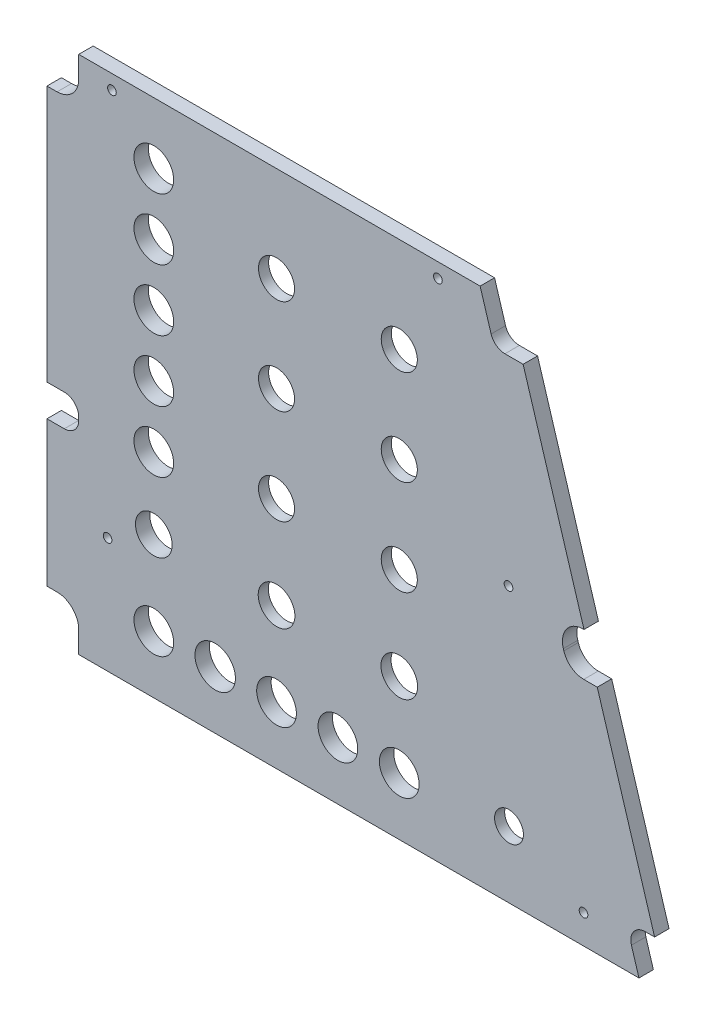
from build123d import *

# Parameters (mm, degrees)
SKETCH1_R           = 6.875
SKETCH1_R_2         = 6.25
SKETCH1_R_3         = 6.35
SKETCH1_R_4         = 7
SKETCH1_R_5         = 5
SKETCH1_R_6         = 1.5
BOSS_EXTRUDE1_DEPTH = 5
CUT_EXTRUDE1_START  = -5
SKETCH6_R           = 10
CUT_EXTRUDE1_DEPTH  = 1.5
CUT_EXTRUDE2_DEPTH  = 5


with BuildPart() as part:
    # Sketch1 → Boss-Extrude1 (new body)
    with BuildSketch(Plane.XY):
        Polygon((-74.139483312, 85.643418081), (85.860516688, 85.643418081), (140.860516688, -94.356581919), (-74.139483312, -94.356581919), align=None)
        with Locations((-37.139483312, 64.393418081)):
            Circle(SKETCH1_R, mode=Mode.SUBTRACT)
        with Locations((-37.139483312, 43.143418081)):
            Circle(SKETCH1_R, mode=Mode.SUBTRACT)
        with Locations((-37.139483312, 21.893418081)):
            Circle(SKETCH1_R, mode=Mode.SUBTRACT)
        with Locations((-37.139483312, 0.643418081)):
            Circle(SKETCH1_R, mode=Mode.SUBTRACT)
        with Locations((-37.139483312, -20.606581919)):
            Circle(SKETCH1_R, mode=Mode.SUBTRACT)
        with Locations((5.360516688, 52.643418081)):
            Circle(SKETCH1_R_2, mode=Mode.SUBTRACT)
        with Locations((5.360516688, 19.643418081)):
            Circle(SKETCH1_R_2, mode=Mode.SUBTRACT)
        with Locations((5.360516688, -13.356581919)):
            Circle(SKETCH1_R_2, mode=Mode.SUBTRACT)
        with Locations(Location((47.860516688, -13.356581919, 0), (0, 0, 180))):
            Circle(SKETCH1_R_2, mode=Mode.SUBTRACT)
        with Locations(Location((47.860516688, 19.643418081, 0), (0, 0, 180))):
            Circle(SKETCH1_R_2, mode=Mode.SUBTRACT)
        with Locations(Location((47.860516688, 52.643418081, 0), (0, 0, 180))):
            Circle(SKETCH1_R_2, mode=Mode.SUBTRACT)
        with Locations((-37.139483312, -45.356581919)):
            Circle(SKETCH1_R_3, mode=Mode.SUBTRACT)
        with Locations((5.360516688, -45.356581919)):
            Circle(SKETCH1_R_3, mode=Mode.SUBTRACT)
        with Locations((47.860516688, -45.356581919)):
            Circle(SKETCH1_R_3, mode=Mode.SUBTRACT)
        with Locations((-37.139483312, -74.356581919)):
            Circle(SKETCH1_R, mode=Mode.SUBTRACT)
        with Locations((-15.889483312, -74.356581919)):
            Circle(SKETCH1_R_4, mode=Mode.SUBTRACT)
        with Locations((5.360516688, -74.356581919)):
            Circle(SKETCH1_R, mode=Mode.SUBTRACT)
        with Locations((26.610516688, -74.356581919)):
            Circle(SKETCH1_R, mode=Mode.SUBTRACT)
        with Locations((47.860516688, -74.356581919)):
            Circle(SKETCH1_R, mode=Mode.SUBTRACT)
        with Locations((85.860516688, -71.356581919)):
            Circle(SKETCH1_R_5, mode=Mode.SUBTRACT)
        with Locations((-51.639483312, 80.643418081)):
            Circle(SKETCH1_R_6, mode=Mode.SUBTRACT)
        with Locations((61.247280265, 80.643418081)):
            Circle(SKETCH1_R_6, mode=Mode.SUBTRACT)
        with Locations((85.691724709, 0.643418081)):
            Circle(SKETCH1_R_6, mode=Mode.SUBTRACT)
        with Locations((111.663946931, -84.356581919)):
            Circle(SKETCH1_R_6, mode=Mode.SUBTRACT)
        with Locations((-53.139483312, -54.356581919)):
            Circle(SKETCH1_R_6, mode=Mode.SUBTRACT)
    extrude(amount=BOSS_EXTRUDE1_DEPTH)

    # Sketch6 → Cut-Extrude1 (cut)
    with BuildSketch(Plane.XY.offset(5).offset(CUT_EXTRUDE1_START)):
        with Locations((5.360516688, 52.643418081)):
            Circle(SKETCH6_R)
        with Locations((47.860516688, 52.643418081)):
            Circle(SKETCH6_R)
        with Locations((47.860516688, -45.356581919)):
            Circle(SKETCH6_R)
        with Locations((47.860516688, -13.356581919)):
            Circle(SKETCH6_R)
        with Locations((47.860516688, 19.643418081)):
            Circle(SKETCH6_R)
        with Locations((5.360516688, 19.643418081)):
            Circle(SKETCH6_R)
        with Locations((5.360516688, -13.356581919)):
            Circle(SKETCH6_R)
        with Locations((5.360516688, -45.356581919)):
            Circle(SKETCH6_R)
        with Locations((85.860516688, -71.356581919)):
            Circle(SKETCH6_R)
    extrude(amount=CUT_EXTRUDE1_DEPTH, mode=Mode.SUBTRACT)

    # Sketch3 → Cut-Extrude2 (cut)
    with BuildSketch(Plane.XY):
        with BuildLine():
            Line((-74.139483312, 70.643418081), (-70.639483312, 70.643418081))
            ThreePointArc((-70.639483312, 70.643418081), (-65.336182453, 72.840117222), (-63.139483312, 78.143418081))
            Line((-63.139483312, 78.143418081), (-63.139483312, 85.643418081))
            Line((-63.139483312, 85.643418081), (-74.139483312, 85.643418081))
            Line((-74.139483312, 85.643418081), (-74.139483312, 70.643418081))
        make_face()
        with BuildLine():
            Line((136.277183355, -79.356581919), (133.033163973, -79.356581919))
            ThreePointArc((133.033163973, -79.356581919), (129.014117855, -81.382146123), (128.251406117, -85.817674597))
            Line((128.251406117, -85.817674597), (130.860516688, -94.356581919))
            Line((130.860516688, -94.356581919), (140.860516688, -94.356581919))
            Line((140.860516688, -94.356581919), (136.277183355, -79.356581919))
        make_face()
        with BuildLine():
            Line((75.860516688, 85.643418081), (79.668072784, 73.182325403))
            ThreePointArc((79.668072784, 73.182325403), (81.475394843, 70.624371963), (84.449830639, 69.643418081))
            Line((84.449830639, 69.643418081), (90.749405577, 69.643418081))
            Line((90.749405577, 69.643418081), (85.860516688, 85.643418081))
            Line((85.860516688, 85.643418081), (75.860516688, 85.643418081))
        make_face()
        with BuildLine():
            Line((-74.139483312, -79.356581919), (-70.639483312, -79.356581919))
            ThreePointArc((-70.639483312, -79.356581919), (-65.336182453, -81.553281061), (-63.139483312, -86.856581919))
            Line((-63.139483312, -86.856581919), (-63.139483312, -94.356581919))
            Line((-63.139483312, -94.356581919), (-74.139483312, -94.356581919))
            Line((-74.139483312, -94.356581919), (-74.139483312, -79.356581919))
        make_face()
        with BuildLine():
            Line((-74.139483312, -18.146581919), (-68.139483312, -18.146581919))
            ThreePointArc((-68.139483312, -18.146581919), (-64.603949406, -19.611048014), (-63.139483312, -23.146581919))
            Line((-63.139483312, -23.146581919), (-63.139483312, -24.146581919))
            ThreePointArc((-63.139483312, -24.146581919), (-64.603949406, -27.682115825), (-68.139483312, -29.146581919))
            Line((-68.139483312, -29.146581919), (-74.139483312, -29.146581919))
            Line((-74.139483312, -29.146581919), (-74.139483312, -18.146581919))
        make_face()
        with BuildLine():
            Line((111.83273891, 0.643418081), (116.416072243, -14.356581919))
            Line((116.416072243, -14.356581919), (111.744684333, -14.356581919))
            ThreePointArc((111.744684333, -14.356581919), (107.461496787, -12.944008329), (104.858953022, -9.260555376))
            Line((104.858953022, -9.260555376), (104.675619688, -8.660555376))
            ThreePointArc((104.675619688, -8.660555376), (105.773924591, -2.273394373), (111.561351, 0.643418081))
            Line((111.561351, 0.643418081), (111.83273891, 0.643418081))
        make_face()
    extrude(amount=CUT_EXTRUDE2_DEPTH, mode=Mode.SUBTRACT)


solid = part.part
